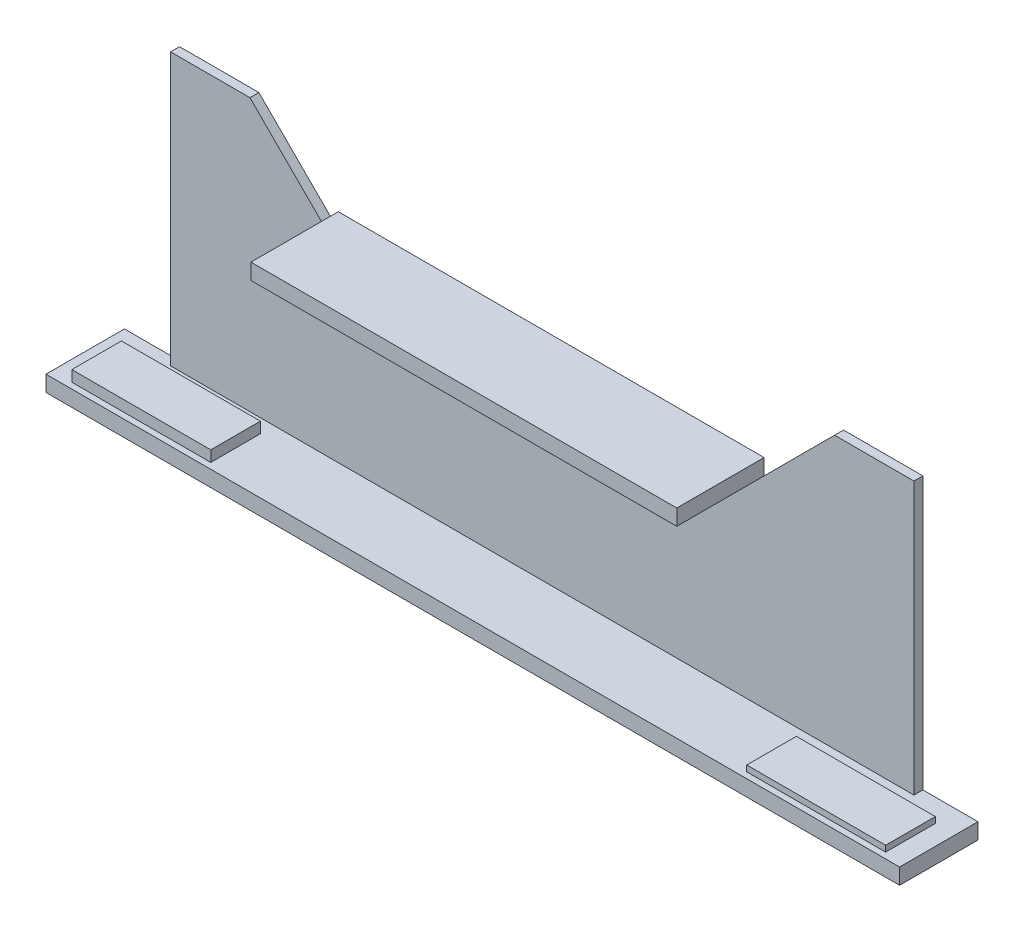
from build123d import *

# Parameters (mm, degrees)
EXTRUDE_2_DEPTH = 9
SKETCH_3_W      = 860
SKETCH_3_H      = 16
EXTRUDE_3_DEPTH = 70
SKETCH_4_W      = 140
SKETCH_4_H      = 50
EXTRUDE_5_DEPTH = 11
SKETCH_6_W      = 140
SKETCH_6_H      = 50
EXTRUDE_6_DEPTH = 6
SKETCH_10_W     = 429
SKETCH_10_H     = 16
EXTRUDE_8_DEPTH = 79


with BuildPart() as part:
    # 草图1 → 凸台-拉伸2 (new body)
    with BuildSketch(Plane.XY):
        Polygon((0, 0), (860, 0), (860, 16), (804.5, 16), (804.5, 290), (724.5, 290), (644.5, 210), (644.5, 226), (215.5, 226), (215.5, 210), (135.5, 290), (55.5, 290), (55.5, 16), (0, 16), align=None)
    extrude(amount=EXTRUDE_2_DEPTH)

    # 草图3 → 凸台-拉伸3 (add)
    with BuildSketch(Plane.XY.offset(9)):
        with Locations((430, 8)):
            Rectangle(SKETCH_3_W, SKETCH_3_H)
    extrude(amount=EXTRUDE_3_DEPTH)

    # 草图4 → 凸台-拉伸5 (add)
    with BuildSketch(Plane(origin=(0, 16, 0), x_dir=(1, 0, 0), z_dir=(0, 1, 0))):
        with Locations((90, -48)):
            Rectangle(SKETCH_4_W, SKETCH_4_H)
    extrude(amount=EXTRUDE_5_DEPTH)

    # 草图6 → 凸台-拉伸6 (add)
    with BuildSketch(Plane(origin=(0, 16, 0), x_dir=(1, 0, 0), z_dir=(0, 1, 0))):
        with Locations((770, -48)):
            Rectangle(SKETCH_6_W, SKETCH_6_H)
    extrude(amount=EXTRUDE_6_DEPTH)

    # 草图10 → 凸台-拉伸8 (add)
    with BuildSketch(Plane.XY.offset(9)):
        with Locations((430, 218)):
            Rectangle(SKETCH_10_W, SKETCH_10_H)
    extrude(amount=EXTRUDE_8_DEPTH)


solid = part.part
